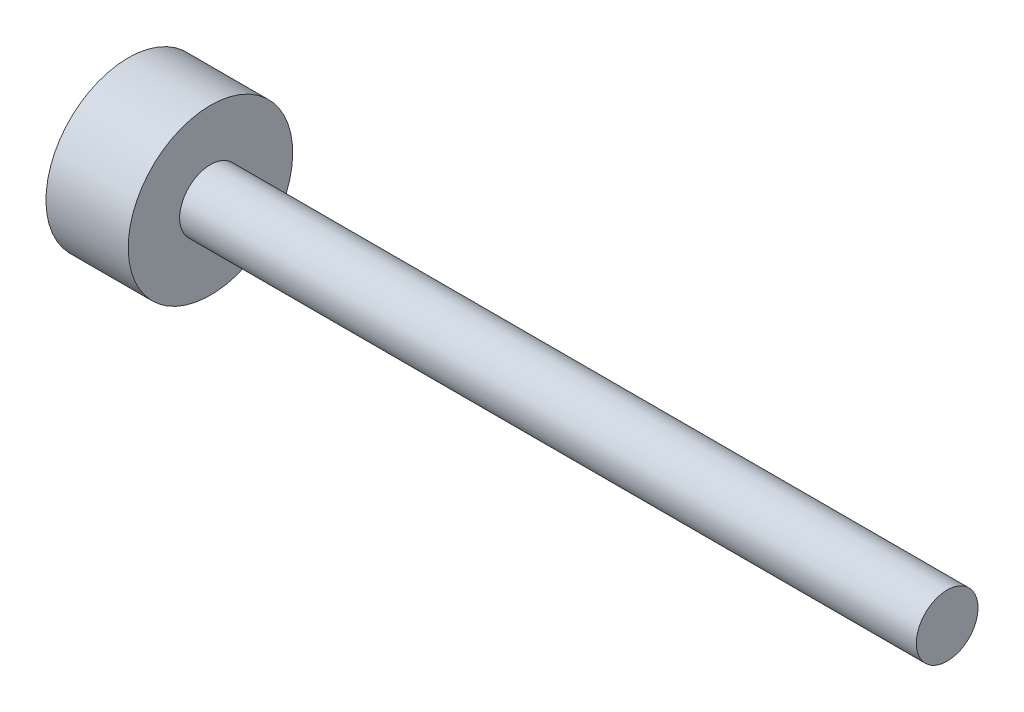
from build123d import *

# Parameters (mm, degrees)
SKETCH1_W = 17.914000002
SKETCH1_H = 0.75


with BuildPart() as part:
    # Sketch1 → Revolve1 (revolve)
    with BuildSketch(Plane.XY):
        with Locations((-8.957000001, 0.375)):
            Rectangle(SKETCH1_W, SKETCH1_H)
        Polygon((-19.914000002, 0), (-17.914000002, 0), (-17.914000002, 0.75), (-17.914000002, 2), (-19.914000002, 2), align=None)
    revolve(axis=Axis((0, 0, 0), (-1, 0, 0)))


solid = part.part
